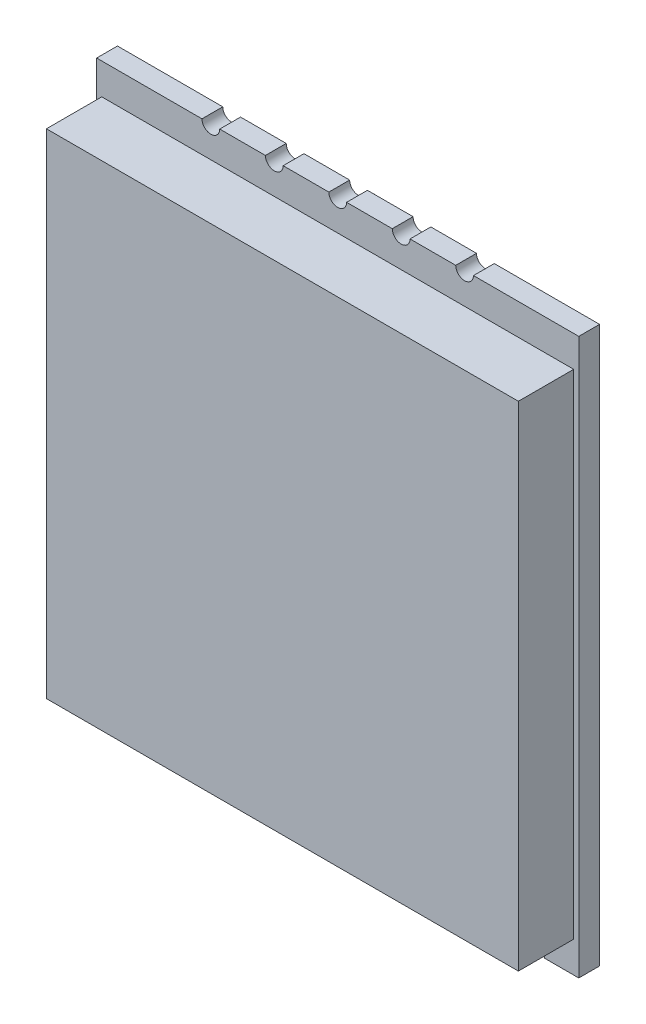
from build123d import *

# Parameters (mm, degrees)
SKETCH1_W           = 19
SKETCH1_H           = 21.9
BOSS_EXTRUDE1_DEPTH = 0.82
SKETCH2_W           = 18.6
SKETCH2_H           = 19.45
BOSS_EXTRUDE2_DEPTH = 2.18
SKETCH3_R           = 0.35
CUT_EXTRUDE1_DEPTH  = 30.075116509


with BuildPart() as part:
    # Sketch1 → Boss-Extrude1 (new body)
    with BuildSketch(Plane.XY):
        with Locations((9.5, 10.95)):
            Rectangle(SKETCH1_W, SKETCH1_H)
    extrude(amount=BOSS_EXTRUDE1_DEPTH)

    # Sketch2 → Boss-Extrude2 (add)
    with BuildSketch(Plane.XY.offset(0.82)):
        with Locations((9.5, 10.95)):
            Rectangle(SKETCH2_W, SKETCH2_H)
    extrude(amount=BOSS_EXTRUDE2_DEPTH)

    # Sketch3 → Cut-Extrude1 (cut, through all)
    with BuildSketch(Plane.XY.offset(0.82)):
        with Locations((4.5, 21.9)):
            Circle(SKETCH3_R)
        with Locations((7, 21.9)):
            Circle(SKETCH3_R)
        with Locations((9.5, 21.9)):
            Circle(SKETCH3_R)
        with Locations((12, 21.9)):
            Circle(SKETCH3_R)
        with Locations((14.5, 21.9)):
            Circle(SKETCH3_R)
        with Locations((4.3, 0)):
            Circle(SKETCH3_R)
        with Locations((6.9, 0)):
            Circle(SKETCH3_R)
        with Locations((9.5, 0)):
            Circle(SKETCH3_R)
        with Locations((12.1, 0)):
            Circle(SKETCH3_R)
        with Locations((14.7, 0)):
            Circle(SKETCH3_R)
        with Locations((17.3, 0)):
            Circle(SKETCH3_R)
    extrude(amount=-CUT_EXTRUDE1_DEPTH, mode=Mode.SUBTRACT)


solid = part.part
